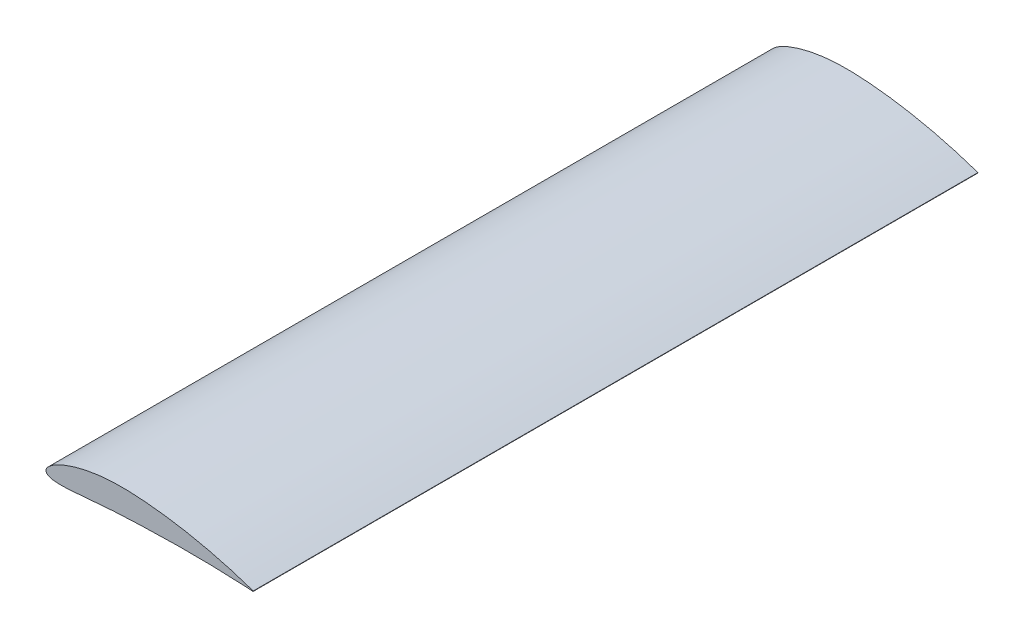
from build123d import *

# Parameters (mm, degrees)
BOSS_EXTRUDE1_DEPTH = 7000
SCALE1_SCALE_X      = 2
SCALE1_SCALE_Y      = 2
SCALE1_SCALE_Z      = 1


with BuildPart() as part:
    # Sketch1 → Boss-Extrude1 (new body)
    with BuildSketch(Plane.XY):
        with BuildLine():
            ThreePointArc((1000.25, 1.24), (1000.667663109, 0.510592115), (1000, 0))
            add(Edge.make_bspline(
                [(1000.25, 1.24), (999.359986733, 1.546627141), (995.813904866, 2.768322351), (987.876181515, 5.507726427), (974.713552313, 9.927470265), (956.46497489, 15.944617919), (933.286110213, 23.312330975), (905.393548715, 31.80086974), (873.061114604, 41.144194501), (836.599559429, 51.04825128), (796.376235795, 61.214300276), (752.795321169, 71.320909449), (706.323073508, 81.114388884), (657.44463467, 90.277605231), (606.687130129, 98.541027751), (554.60786587, 105.690076191), (501.792006277, 111.495197959), (448.806162518, 115.772152486), (395.889626722, 118.580850169), (343.608181984, 118.911427272), (292.692483943, 116.356979743), (244.199020949, 111.172787561), (198.769296966, 103.664846496), (157.001162221, 94.160809085), (119.418146944, 83.124687033), (86.459556294, 71.051156507), (58.480036291, 58.428706114), (35.744542347, 45.743721893), (18.353999729, 33.444466273), (6.401621543, 21.798324975), (-0.47845216, 10.768701919), (-1.10214415, -0.332227416), (5.478288993, -9.225778319), (17.014271606, -14.794817415), (32.874717935, -18.451093615), (53.308450376, -20.367512745), (78.111841576, -20.751175566), (107.047459749, -19.763290021), (139.789646319, -17.647459974), (176.002158375, -14.653980899), (215.332862214, -11.125048297), (257.427333857, -7.362371321), (301.920896092, -3.692196276), (348.444123616, -0.455682333), (396.981647816, 1.983190356), (447.101334104, 3.705863118), (498.278261343, 5.481831346), (549.622056364, 6.900537811), (600.559869201, 7.927879902), (650.548430925, 8.504074658), (699.037235161, 8.606874061), (745.485785344, 8.266303419), (789.370482429, 7.5597936), (830.185157221, 6.508883977), (867.451585098, 5.296773134), (900.743884279, 3.94315847), (929.597195908, 2.653922878), (953.856991757, 1.286229174), (972.676379869, 0.624047351), (987.169605739, -1.05840053), (994.352076053, -0.014436898), (999.879826135, -2.048097838), (999.971559795, -0.484700421), (1000, 0)],
                knots=[0, 0, 0, 0, 0.001371577, 0.005464776, 0.012234802, 0.021601969, 0.033461345, 0.04767125, 0.064081318, 0.082496261, 0.102719149, 0.124527079, 0.147675648, 0.171912573, 0.19697838, 0.222596912, 0.248496767, 0.274385101, 0.300041178, 0.325689988, 0.350525088, 0.374279703, 0.396711254, 0.417576734, 0.436654006, 0.45374439, 0.468679994, 0.481329415, 0.491630702, 0.499615789, 0.505546281, 0.510184984, 0.514824194, 0.520701508, 0.52851604, 0.538465752, 0.550542609, 0.564643256, 0.580638139, 0.598344876, 0.617584458, 0.638174401, 0.65992209, 0.682632113, 0.706120665, 0.730727383, 0.755700244, 0.780731769, 0.805564463, 0.829932396, 0.853570292, 0.876213105, 0.897609987, 0.917519394, 0.935698347, 0.951942678, 0.966047159, 0.97783994, 0.987174002, 0.993931501, 0.998018399, 0.999385644, 1, 1, 1, 1], degree=3))
        make_face()
    extrude(amount=BOSS_EXTRUDE1_DEPTH)


with BuildPart() as part_1:
    # Scale1: scaled about (0, 0, 0)
    add(part.part.scale((SCALE1_SCALE_X, SCALE1_SCALE_Y, SCALE1_SCALE_Z), about=(0, 0, 0)))


solid = part_1.part
